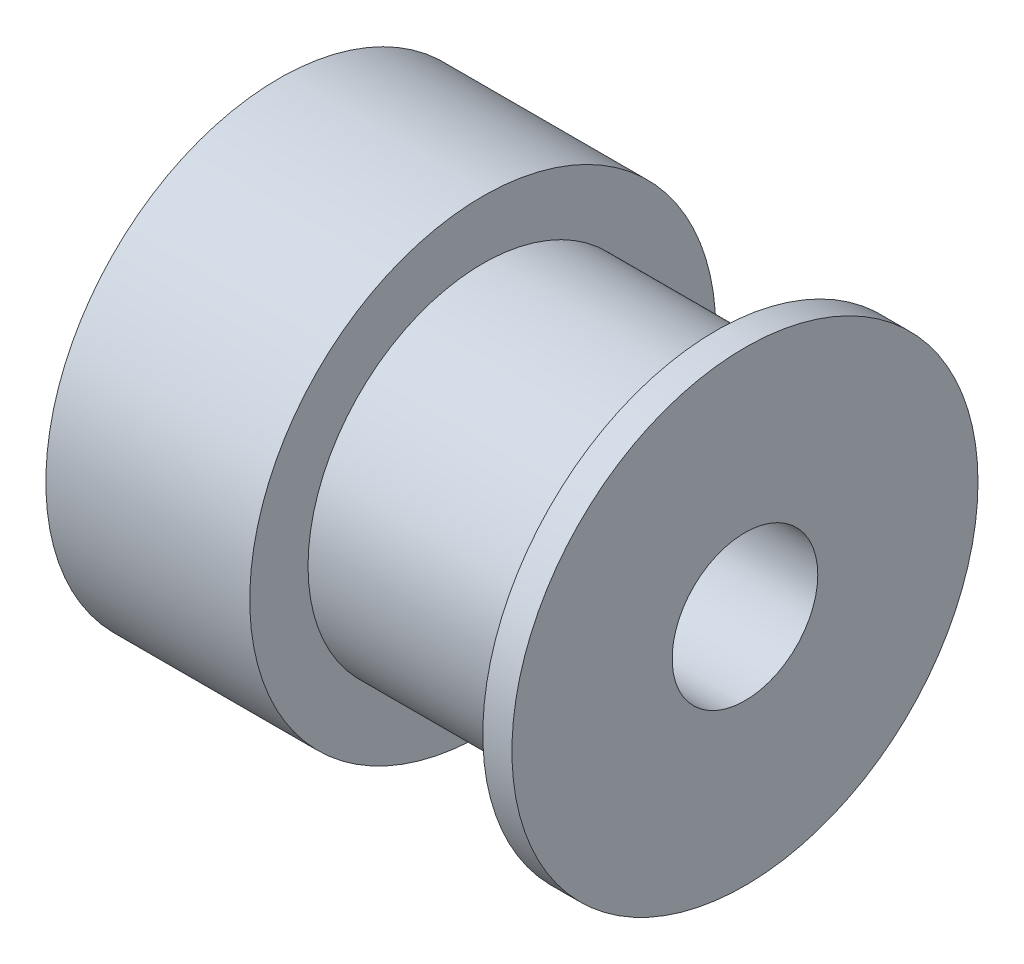
from build123d import *


with BuildPart() as part:
    # 草圖1 → 旋轉1 (revolve)
    with BuildSketch(Plane.XY, mode=Mode.PRIVATE) as revolve_1_sk:
        Polygon((0, 2.5), (-16, 2.5), (-16, 8), (-9, 8), (-9, 6), (-1, 6), (-1, 8), (0, 8), align=None)
    revolve(revolve_1_sk.sketch.rotate(Axis((0, 0, 0), (-1, 0, 0)), 90), axis=Axis((0, 0, 0), (-1, 0, 0)))


solid = part.part
